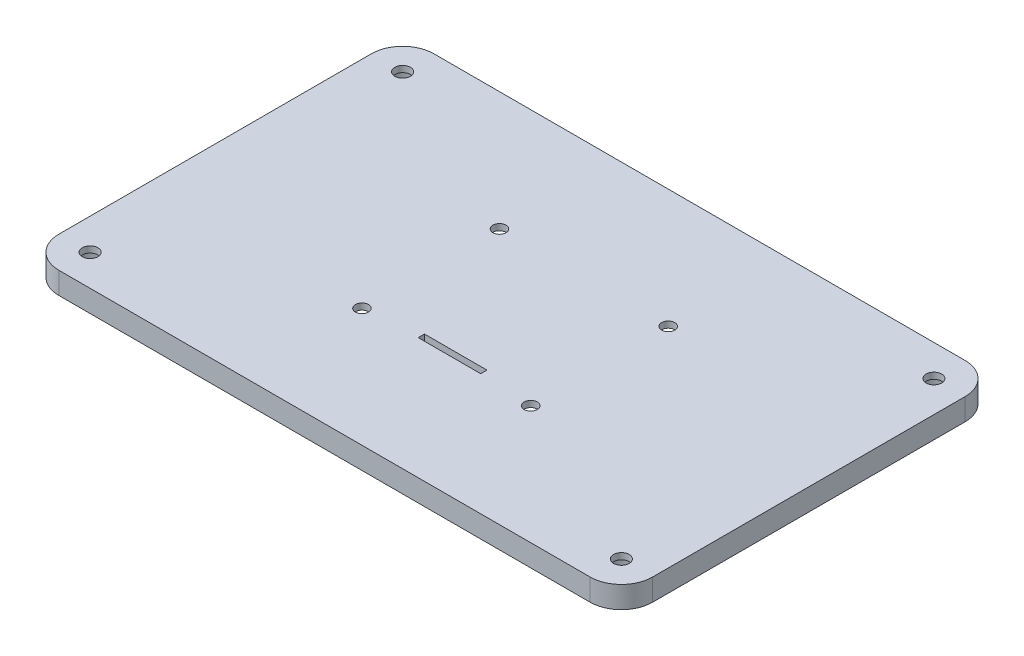
from build123d import *

# Parameters (mm, degrees)
SKETCH1_R                      = 5.5
BOSS_EXTRUDE1_DEPTH            = 5
BOSS_EXTRUDE2_DEPTH            = 2
SKETCH4_R                      = 1.4
BOSS_EXTRUDE3_DEPTH            = 7
SKETCH12_W                     = 20
SKETCH12_H                     = 2
CUT_EXTRUDE1_DEPTH             = 10
F_4_2_4_2_DIAMETER_HOLE1_D     = 4.2
F_4_2_4_2_DIAMETER_HOLE1_DEPTH = 20
F_4_2_4_2_DIAMETER_HOLE1_TIP   = 1.2618073
F_5_0_5_DIAMETER_HOLE1_D       = 5
F_5_0_5_DIAMETER_HOLE1_DEPTH   = 5
F_5_0_5_DIAMETER_HOLE1_TIP     = 1.502151548


with BuildPart() as part:
    # Sketch1 → Boss-Extrude1 (new body)
    with BuildSketch(Plane(origin=(0, 111.722415865, 0), x_dir=(1, 0, 0), z_dir=(0, 1, 0))):
        with BuildLine():
            Line((241.95107426, 942.218289838), (411.95107426, 942.218289838))
            ThreePointArc((411.95107426, 942.218289838), (419.022142072, 945.147222026), (421.95107426, 952.218289838))
            Line((421.95107426, 952.218289838), (421.95107426, 1052.218289838))
            ThreePointArc((421.95107426, 1052.218289838), (419.022142072, 1059.28935765), (411.95107426, 1062.218289838))
            Line((411.95107426, 1062.218289838), (241.95107426, 1062.218289838))
            ThreePointArc((241.95107426, 1062.218289838), (234.880006448, 1059.28935765), (231.95107426, 1052.218289838))
            Line((231.95107426, 1052.218289838), (231.95107426, 952.218289838))
            ThreePointArc((231.95107426, 952.218289838), (234.880006448, 945.147222026), (241.95107426, 942.218289838))
        make_face()
        with Locations(Location((241.95107426, 952.218289838, 0), (0, 0, 270))):
            Circle(SKETCH1_R, mode=Mode.SUBTRACT)
        with Locations(Location((411.95107426, 952.218289838, 0), (0, 0, 270))):
            Circle(SKETCH1_R, mode=Mode.SUBTRACT)
        with Locations(Location((411.95107426, 1052.218289838, 0), (0, 0, 270))):
            Circle(SKETCH1_R, mode=Mode.SUBTRACT)
        with Locations(Location((241.95107426, 1052.218289838, 0), (0, 0, 270))):
            Circle(SKETCH1_R, mode=Mode.SUBTRACT)
        with BuildLine():
            Line((249.45107426, 952.218289838), (249.45107426, 944.718289838))
            Line((249.45107426, 944.718289838), (404.45107426, 944.718289838))
            Line((404.45107426, 944.718289838), (404.45107426, 952.218289838))
            ThreePointArc((404.45107426, 952.218289838), (406.647773401, 957.521590697), (411.95107426, 959.718289838))
            Line((411.95107426, 959.718289838), (419.45107426, 959.718289838))
            Line((419.45107426, 959.718289838), (419.45107426, 1044.718289838))
            Line((419.45107426, 1044.718289838), (411.95107426, 1044.718289838))
            ThreePointArc((411.95107426, 1044.718289838), (406.647773401, 1046.914988979), (404.45107426, 1052.218289838))
            Line((404.45107426, 1052.218289838), (404.45107426, 1059.718289838))
            Line((404.45107426, 1059.718289838), (249.45107426, 1059.718289838))
            Line((249.45107426, 1059.718289838), (249.45107426, 1052.218289838))
            ThreePointArc((249.45107426, 1052.218289838), (247.254375119, 1046.914988979), (241.95107426, 1044.718289838))
            Line((241.95107426, 1044.718289838), (234.45107426, 1044.718289838))
            Line((234.45107426, 1044.718289838), (234.45107426, 959.718289838))
            Line((234.45107426, 959.718289838), (241.95107426, 959.718289838))
            ThreePointArc((241.95107426, 959.718289838), (247.254375119, 957.521590697), (249.45107426, 952.218289838))
        make_face(mode=Mode.SUBTRACT)
    extrude(amount=BOSS_EXTRUDE1_DEPTH)

    # Sketch2 → Boss-Extrude2 (add)
    with BuildSketch(Plane(origin=(0, 116.722415865, 0), x_dir=(1, 0, 0), z_dir=(0, 1, 0))):
        with BuildLine():
            Line((231.95107426, 1052.218289838), (231.95107426, 952.218289838))
            ThreePointArc((231.95107426, 952.218289838), (234.880006448, 945.147222026), (241.95107426, 942.218289838))
            Line((241.95107426, 942.218289838), (411.95107426, 942.218289838))
            ThreePointArc((411.95107426, 942.218289838), (419.022142072, 945.147222026), (421.95107426, 952.218289838))
            Line((421.95107426, 952.218289838), (421.95107426, 1052.218289838))
            ThreePointArc((421.95107426, 1052.218289838), (419.022142072, 1059.28935765), (411.95107426, 1062.218289838))
            Line((411.95107426, 1062.218289838), (241.95107426, 1062.218289838))
            ThreePointArc((241.95107426, 1062.218289838), (234.880006448, 1059.28935765), (231.95107426, 1052.218289838))
        make_face()
    extrude(amount=BOSS_EXTRUDE2_DEPTH)

    # Sketch4 → Boss-Extrude3 (add)
    with BuildSketch(Plane(origin=(0, 118.722415865, 0), x_dir=(1, 0, 0), z_dir=(0, 1, 0))):
        with BuildLine():
            Line((375.86522753, 1030.272411662), (375.86522753, 1031.672411662))
            Line((375.86522753, 1031.672411662), (377.26522753, 1031.672411662))
            ThreePointArc((377.26522753, 1031.672411662), (374.875278036, 1032.662361156), (375.86522753, 1030.272411662))
        make_face()
        with BuildLine():
            Line((377.26522753, 1031.672411662), (375.86522753, 1031.672411662))
            Line((375.86522753, 1031.672411662), (375.86522753, 1030.272411662))
            ThreePointArc((375.86522753, 1030.272411662), (376.855177023, 1030.682462168), (377.26522753, 1031.672411662))
        make_face()
        with BuildLine():
            ThreePointArc((377.26522753, 1007.672411662), (376.855177023, 1008.662361156), (375.86522753, 1009.072411662))
            Line((375.86522753, 1009.072411662), (375.86522753, 1007.672411662))
            Line((375.86522753, 1007.672411662), (377.26522753, 1007.672411662))
        make_face()
        with BuildLine():
            Line((375.86522753, 1007.672411662), (375.86522753, 1009.072411662))
            ThreePointArc((375.86522753, 1009.072411662), (374.875278036, 1006.682462168), (377.26522753, 1007.672411662))
            Line((377.26522753, 1007.672411662), (375.86522753, 1007.672411662))
        make_face()
        with Locations(Location((399.86522753, 1031.672411662, 0), (0, 0, 180))):
            Circle(SKETCH4_R)
        with Locations(Location((399.86522753, 1007.672411662, 0), (0, 0, 180))):
            Circle(SKETCH4_R)
    extrude(amount=-BOSS_EXTRUDE3_DEPTH)

    # Sketch12 → Cut-Extrude1 (cut)
    with BuildSketch(Plane(origin=(0, 118.722415865, 0), x_dir=(1, 0, 0), z_dir=(0, 1, 0))):
        with Locations((328.108762335, 982.045276567)):
            Rectangle(SKETCH12_W, SKETCH12_H)
    extrude(amount=-CUT_EXTRUDE1_DEPTH, mode=Mode.SUBTRACT)

    # Ø4.2 (4.2) Diameter Hole1
    with Locations(Plane(origin=(0, 118.722415865, 0), x_dir=(1, 0, 0), z_dir=(0, 1, 0))):
        with Locations((300.990952506, 1024.17077451), (354.990952506, 1024.17077451), (354.990952506, 980.17077451), (300.990952506, 980.17077451)):
            Hole(F_4_2_4_2_DIAMETER_HOLE1_D / 2, depth=F_4_2_4_2_DIAMETER_HOLE1_DEPTH)
            with Locations((0, 0, -(F_4_2_4_2_DIAMETER_HOLE1_DEPTH + F_4_2_4_2_DIAMETER_HOLE1_TIP / 2))):  # 118° drill point
                Cone(0, F_4_2_4_2_DIAMETER_HOLE1_D / 2, F_4_2_4_2_DIAMETER_HOLE1_TIP, mode=Mode.SUBTRACT)

    # Ø5.0 (5) Diameter Hole1
    with Locations(Plane(origin=(0, 118.722415865, 0), x_dir=(1, 0, 0), z_dir=(0, 1, 0))):
        with Locations((241.95107426, 1052.218289838), (411.95107426, 1052.218289838), (411.95107426, 952.218289838), (241.95107426, 952.218289838)):
            Hole(F_5_0_5_DIAMETER_HOLE1_D / 2, depth=F_5_0_5_DIAMETER_HOLE1_DEPTH)
            with Locations((0, 0, -(F_5_0_5_DIAMETER_HOLE1_DEPTH + F_5_0_5_DIAMETER_HOLE1_TIP / 2))):  # 118° drill point
                Cone(0, F_5_0_5_DIAMETER_HOLE1_D / 2, F_5_0_5_DIAMETER_HOLE1_TIP, mode=Mode.SUBTRACT)


solid = part.part
